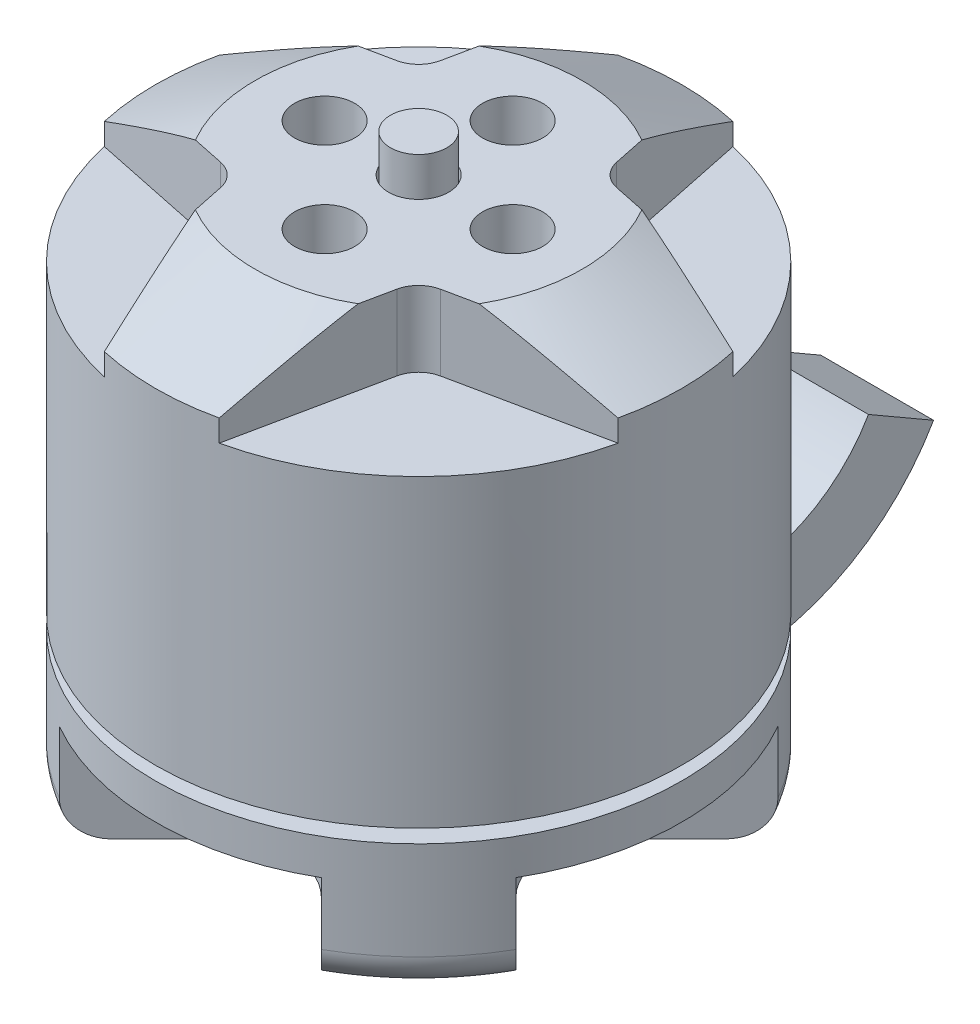
from build123d import *

# Parameters (mm, degrees)
M2X0_4_TAPPED_HOLE1_D     = 1.6
M2X0_4_TAPPED_HOLE1_DEPTH = 3.2
M2X0_4_TAPPED_HOLE1_TIP   = 0.480688495
M2X0_4_TAPPED_HOLE2_D     = 1.6
M2X0_4_TAPPED_HOLE2_DEPTH = 5.2
M2X0_4_TAPPED_HOLE2_TIP   = 0.480688495
CHAMFER1_SIZE             = 2.65
CHAMFER1_SIZE2            = 1.42
FILLET1_R                 = 0.935
CUT_EXTRUDE1_DEPTH        = 2.59
SKETCH13_W                = 9.661742765
SKETCH13_H                = 0.36
SKETCH7_W                 = 3
SKETCH7_H                 = 2
REVOLVE3_ANGLE            = 60
REVOLVE3_OTHER_WAY_ANGLE  = 10
CUT_EXTRUDE2_DEPTH        = 2
BOSS_EXTRUDE2_START       = -15.9
SKETCH15_R                = 0.75
BOSS_EXTRUDE2_DEPTH       = 15.9


with BuildPart() as part:
    # Sketch1 → Revolve1 (revolve)
    with BuildSketch(Plane.XY, mode=Mode.PRIVATE) as revolve1_sk:
        Polygon((-0.75, 0), (-7, 0), (-7, 14), (-0.75, 14), (-0.75, 16.6), (0, 16.6), (0, -0.9), (-0.75, -0.9), align=None)
    revolve(revolve1_sk.sketch.rotate(Axis((0, -74.460023863, 0), (0, 1, 0)), 270), axis=Axis((0, -74.460023863, 0), (0, 1, 0)))

    # M2x0.4 Tapped Hole1
    with Locations(Plane(origin=(0, 0, 0), x_dir=(-1, 0, 0), z_dir=(0, -1, 0))):
        with Locations((3.181980515, -3.181980515), (-3.181980515, -3.181980515), (-3.181980515, 3.181980515), (3.181980515, 3.181980515)):
            Hole(M2X0_4_TAPPED_HOLE1_D / 2, depth=M2X0_4_TAPPED_HOLE1_DEPTH)
            with Locations((0, 0, -(M2X0_4_TAPPED_HOLE1_DEPTH + M2X0_4_TAPPED_HOLE1_TIP / 2))):  # 118° drill point
                Cone(0, M2X0_4_TAPPED_HOLE1_D / 2, M2X0_4_TAPPED_HOLE1_TIP, mode=Mode.SUBTRACT)

    # M2x0.4 Tapped Hole2
    with Locations(Plane(origin=(0, 14, 0), x_dir=(1, 0, 0), z_dir=(0, 1, 0))):
        with Locations((0, 2.5), (2.5, 0), (0, -2.5), (-2.5, 0), (0, 0)):
            Hole(M2X0_4_TAPPED_HOLE2_D / 2, depth=M2X0_4_TAPPED_HOLE2_DEPTH)
            with Locations((0, 0, -(M2X0_4_TAPPED_HOLE2_DEPTH + M2X0_4_TAPPED_HOLE2_TIP / 2))):  # 118° drill point
                Cone(0, M2X0_4_TAPPED_HOLE2_D / 2, M2X0_4_TAPPED_HOLE2_TIP, mode=Mode.SUBTRACT)

    # Chamfer1
    chamfer1_edges = [part.edges().sort_by_distance(p)[0] for p in [
        (0, 14, 7),
    ]]
    chamfer1_side = [part.faces().sort_by_distance(p)[0] for p in [
        (0, 14, 6.802010101),
    ]]
    chamfer(chamfer1_edges, length=CHAMFER1_SIZE, length2=CHAMFER1_SIZE2, reference=chamfer1_side[0])

    # Fillet1
    fillet1_edges = [part.edges().sort_by_distance(p)[0] for p in [
        (0, 0, 7),
    ]]
    fillet(fillet1_edges, radius=FILLET1_R)

    # Sketch10 → Cut-Extrude1 (cut)
    with BuildSketch(Plane(origin=(0, 0, 0), x_dir=(-1, 0, 0), z_dir=(0, -1, 0))):
        with BuildLine():
            Line((1.33664614, 3.924656959), (4.411989181, 7))
            Line((4.411989181, 7), (-4.411989181, 7))
            Line((-4.411989181, 7), (-1.33664614, 3.924656959))
            ThreePointArc((-1.33664614, 3.924656959), (0, 3.371), (1.33664614, 3.924656959))
        make_face()
        with BuildLine():
            Line((3.924656959, 1.33664614), (7, 4.411989181))
            Line((7, 4.411989181), (7, -4.411989181))
            Line((7, -4.411989181), (3.924656959, -1.33664614))
            ThreePointArc((3.924656959, -1.33664614), (3.371, 0), (3.924656959, 1.33664614))
        make_face()
        with BuildLine():
            Line((1.33664614, -3.924656959), (4.411989181, -7))
            Line((4.411989181, -7), (-4.411989181, -7))
            Line((-4.411989181, -7), (-1.33664614, -3.924656959))
            ThreePointArc((-1.33664614, -3.924656959), (0, -3.371), (1.33664614, -3.924656959))
        make_face()
        with BuildLine():
            Line((-3.924656959, -1.33664614), (-7, -4.411989181))
            Line((-7, -4.411989181), (-7, 4.411989181))
            Line((-7, 4.411989181), (-3.924656959, 1.33664614))
            ThreePointArc((-3.924656959, 1.33664614), (-3.371, 0), (-3.924656959, -1.33664614))
        make_face()
    extrude(amount=-CUT_EXTRUDE1_DEPTH, mode=Mode.SUBTRACT)

    # Sketch13 → Cut-Revolve1 (revolve, cut)
    with BuildSketch(Plane.XY, mode=Mode.PRIVATE) as cut_revolve1_sk:
        with Locations((9.100871383, 3.72)):
            Rectangle(SKETCH13_W, SKETCH13_H)
    revolve(cut_revolve1_sk.sketch.rotate(Axis((0, 7.126821905, 0), (0, -1, 0)), 90), axis=Axis((0, 7.126821905, 0), (0, -1, 0)), mode=Mode.SUBTRACT)

    # Sketch14 → Cut-Extrude2 (cut)
    with BuildSketch(Plane(origin=(0, 14, 0), x_dir=(1, 0, 0), z_dir=(0, 1, 0))):
        with BuildLine():
            Line((-2.341662096, -2.92303085), (-1.527912945, -6.831213804))
            ThreePointArc((-1.527912945, -6.831213804), (-4.949747468, -4.949747468), (-6.831213804, -1.527912945))
            Line((-6.831213804, -1.527912945), (-2.92303085, -2.341662096))
            ThreePointArc((-2.92303085, -2.341662096), (-2.545584412, -2.545584412), (-2.341662096, -2.92303085))
        make_face()
        with BuildLine():
            Line((2.92303085, -2.341662096), (6.831213804, -1.527912945))
            ThreePointArc((6.831213804, -1.527912945), (4.949747468, -4.949747468), (1.527912945, -6.831213804))
            Line((1.527912945, -6.831213804), (2.341662096, -2.92303085))
            ThreePointArc((2.341662096, -2.92303085), (2.545584412, -2.545584412), (2.92303085, -2.341662096))
        make_face()
        with BuildLine():
            Line((-2.92303085, 2.341662096), (-6.831213804, 1.527912945))
            ThreePointArc((-6.831213804, 1.527912945), (-4.949747468, 4.949747468), (-1.527912945, 6.831213804))
            Line((-1.527912945, 6.831213804), (-2.341662096, 2.92303085))
            ThreePointArc((-2.341662096, 2.92303085), (-2.545584412, 2.545584412), (-2.92303085, 2.341662096))
        make_face()
        with BuildLine():
            Line((2.341662096, 2.92303085), (1.527912945, 6.831213804))
            ThreePointArc((1.527912945, 6.831213804), (4.949747468, 4.949747468), (6.831213804, 1.527912945))
            Line((6.831213804, 1.527912945), (2.92303085, 2.341662096))
            ThreePointArc((2.92303085, 2.341662096), (2.545584412, 2.545584412), (2.341662096, 2.92303085))
        make_face()
    extrude(amount=-CUT_EXTRUDE2_DEPTH, mode=Mode.SUBTRACT)

    # Sketch15 → Boss-Extrude2 (add)
    with BuildSketch(Plane.XZ.offset(0.9).offset(BOSS_EXTRUDE2_START)):
        with Locations(Location((0, 0, 0), (0, 0, 270))):
            Circle(SKETCH15_R)
    extrude(amount=BOSS_EXTRUDE2_DEPTH)


with BuildPart() as body_2:
    # Sketch7 → Revolve3 (revolve)
    with BuildSketch(Plane(origin=(0, 0, -7), x_dir=(-1, 0, 0), z_dir=(0, 0, -1))):
        with Locations((0, 1)):
            Rectangle(SKETCH7_W, SKETCH7_H)
    revolve(axis=Axis((-7, 6, -7), (1, 0, 0)), revolution_arc=REVOLVE3_ANGLE)

    # Sketch7 → Revolve3 other way (revolve)
    with BuildSketch(Plane(origin=(0, 0, -7), x_dir=(-1, 0, 0), z_dir=(0, 0, -1))):
        with Locations((0, 1)):
            Rectangle(SKETCH7_W, SKETCH7_H)
    revolve(axis=Axis((-7, 6, -7), (-1, 0, 0)), revolution_arc=REVOLVE3_OTHER_WAY_ANGLE)


solid = Compound([part.part, body_2.part])
